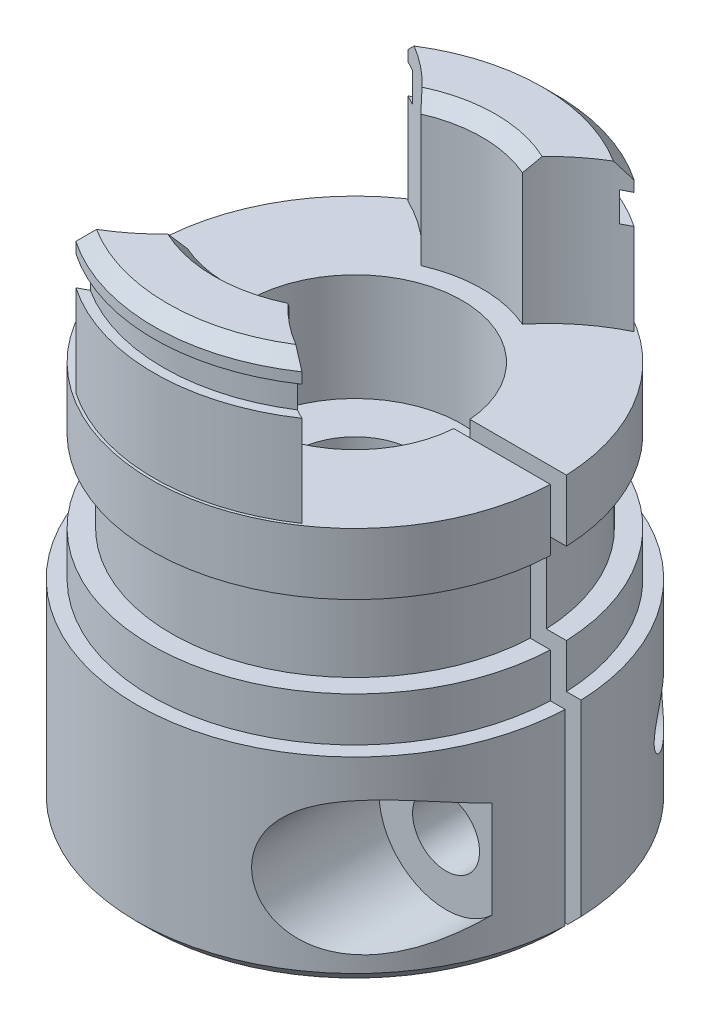
from build123d import *

# Parameters (mm, degrees)
SKETCH3_R          = 6.9
CUT_EXTRUDE1_DEPTH = 6
SKETCH4_R          = 6.9
CUT_EXTRUDE2_DEPTH = 6
CUT_EXTRUDE3_DEPTH = 8.15


with BuildPart() as part:
    # Sketch1 → Revolve1 (revolve)
    with BuildSketch(Plane.XY):
        Polygon((2.25, 9), (4, 9), (4, 0.5), (4.5, 0), (7.65, 0), (8.15, 0.5), (8.15, 7.5), (7.6, 7.5), (7.6, 9.15), (6.85, 9.15), (6.85, 12.2), (7.6, 12.2), (7.6, 14.5), (4, 14.5), (4, 10.5), (2.25, 10.5), align=None)
    revolve(axis=Axis((0, 0, 0), (0, 1, 0)))

    # Sketch2 → Revolve2 (revolve)
    with BuildSketch(Plane(origin=(0, 0, 0), x_dir=(0, 0, -1), z_dir=(1, 0, 0))):
        Polygon((4.75, 14.5), (7.5, 14.5), (7.5, 17.9), (7.15, 17.9), (7.15, 19), (7.5, 19), (7.5, 19.4), (7, 19.9), (5.25, 19.9), (4.75, 19.4), align=None)
    revolve(axis=Axis((0, 14.5, 0), (0, 1, 0)))

    # Sketch3 → Cut-Extrude1 (cut)
    with BuildSketch(Plane(origin=(0, 14.5, 0), x_dir=(1, 0, 0), z_dir=(0, 1, 0))):
        with Locations((7.25, 0)):
            Circle(SKETCH3_R)
    extrude(amount=CUT_EXTRUDE1_DEPTH, mode=Mode.SUBTRACT)

    # Sketch4 → Cut-Extrude2 (cut)
    with BuildSketch(Plane(origin=(0, 14.5, 0), x_dir=(1, 0, 0), z_dir=(0, 1, 0))):
        with Locations((-7.25, 0)):
            Circle(SKETCH4_R)
    extrude(amount=CUT_EXTRUDE2_DEPTH, mode=Mode.SUBTRACT)

    # Sketch5 → Cut-Revolve1 (revolve, cut)
    with BuildSketch(Plane(origin=(0, 3.6, 0), x_dir=(1, 0, 0), z_dir=(0, 1, 0))):
        Polygon((6, 6.55), (7.0065, 6.55), (7.0065, 0.3), (7.25, 0.3), (7.25, -2.6), (8.5, -2.6), (8.5, -8.15), (6, -8.15), align=None)
    revolve(axis=Axis((6, 3.6, 8.15), (0, 0, -1)), mode=Mode.SUBTRACT)

    # Sketch6 → Cut-Extrude3 (cut)
    with BuildSketch(Plane(origin=(0, 0, 0), x_dir=(0, 0, -1), z_dir=(1, 0, 0))):
        with BuildLine():
            Line((-0.3, 19.9), (-0.3, 0))
            Line((-0.3, 0), (0.3, 0))
            Line((0.3, 0), (0.3, 19.9))
            ThreePointArc((0.3, 19.9), (0, 20.2), (-0.3, 19.9))
        make_face()
    extrude(amount=CUT_EXTRUDE3_DEPTH, mode=Mode.SUBTRACT)


solid = part.part
